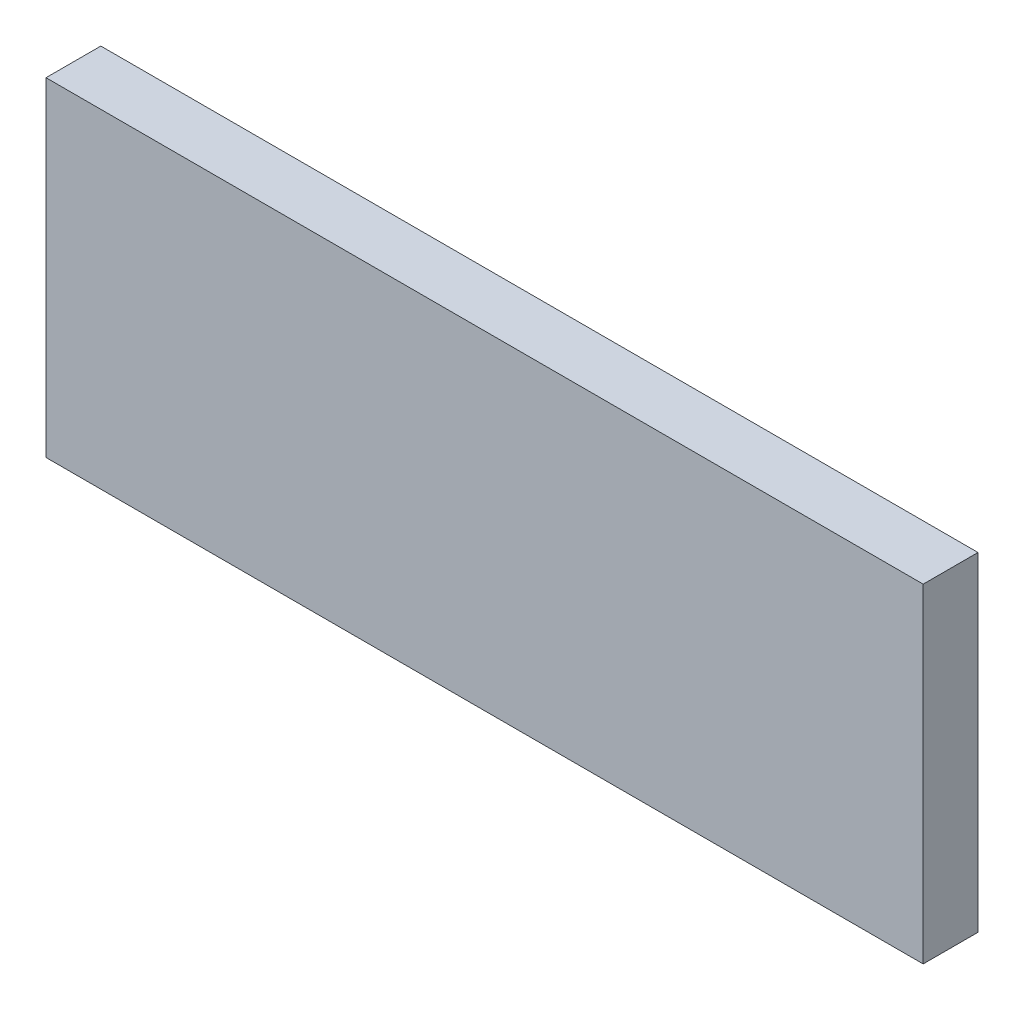
from build123d import *

# Parameters (mm, degrees)
ESQUISSE1_W        = 203.2
ESQUISSE1_H        = 76.2
BOSS_EXTRU_1_DEPTH = 12.7


with BuildPart() as part:
    # Esquisse1 → Boss.-Extru.1 (new body)
    with BuildSketch(Plane.XY):
        Rectangle(ESQUISSE1_W, ESQUISSE1_H)
    extrude(amount=BOSS_EXTRU_1_DEPTH)


solid = part.part
